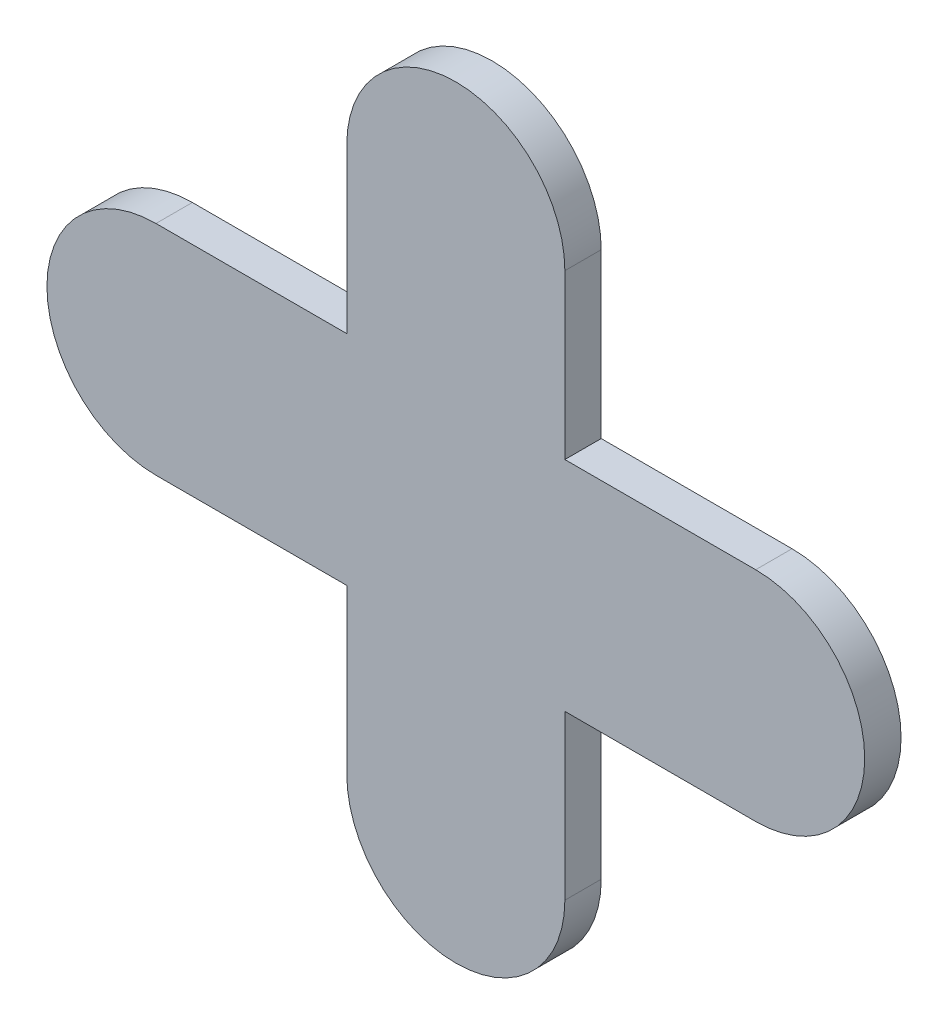
from build123d import *

# Parameters (mm, degrees)
ESQUISSE1_W             = 12
ESQUISSE1_H             = 12
BOSS_EXTRU_1_DEPTH      = 2
ESQUISSE2_R             = 5
BOSS_EXTRU_2_DEPTH      = 2
ESQUISSE3_R             = 2.5
ENL_V_MAT_EXTRU_1_DEPTH = 2


with BuildPart() as part:
    # Esquisse1 → Boss.-Extru.1 (new body)
    with BuildSketch(Plane.XY):
        with BuildLine():
            Line((16.5, 6), (6, 6))
            Line((6, 6), (6, -6))
            Line((6, -6), (16.5, -6))
            ThreePointArc((16.5, -6), (22.5, 0), (16.5, 6))
        make_face()
        Rectangle(ESQUISSE1_W, ESQUISSE1_H)
        with BuildLine():
            Line((-6, 15), (-6, 6))
            Line((-6, 6), (6, 6))
            Line((6, 6), (6, 15))
            ThreePointArc((6, 15), (0, 21), (-6, 15))
        make_face()
        with BuildLine():
            Line((-6, 6), (-16.5, 6))
            ThreePointArc((-16.5, 6), (-22.5, 0), (-16.5, -6))
            Line((-16.5, -6), (-6, -6))
            Line((-6, -6), (-6, 6))
        make_face()
        with BuildLine():
            Line((6, -6), (-6, -6))
            Line((-6, -6), (-6, -15))
            ThreePointArc((-6, -15), (0, -21), (6, -15))
            Line((6, -15), (6, -6))
        make_face()
    extrude(amount=BOSS_EXTRU_1_DEPTH)

    # Esquisse2 → Boss.-Extru.2 (add)
    with BuildSketch(Plane(origin=(0, 0, 0), x_dir=(-1, 0, 0), z_dir=(0, 0, -1))):
        with Locations(Location((0, 0, 0), (0, 0, 180))):
            Circle(ESQUISSE2_R)
    extrude(amount=BOSS_EXTRU_2_DEPTH)

    # Esquisse3 → Enlèv. mat.-Extru.1 (cut)
    with BuildSketch(Plane(origin=(0, 0, -2), x_dir=(-1, 0, 0), z_dir=(0, 0, -1))):
        Circle(ESQUISSE3_R)
    extrude(amount=-ENL_V_MAT_EXTRU_1_DEPTH, mode=Mode.SUBTRACT)


solid = part.part
